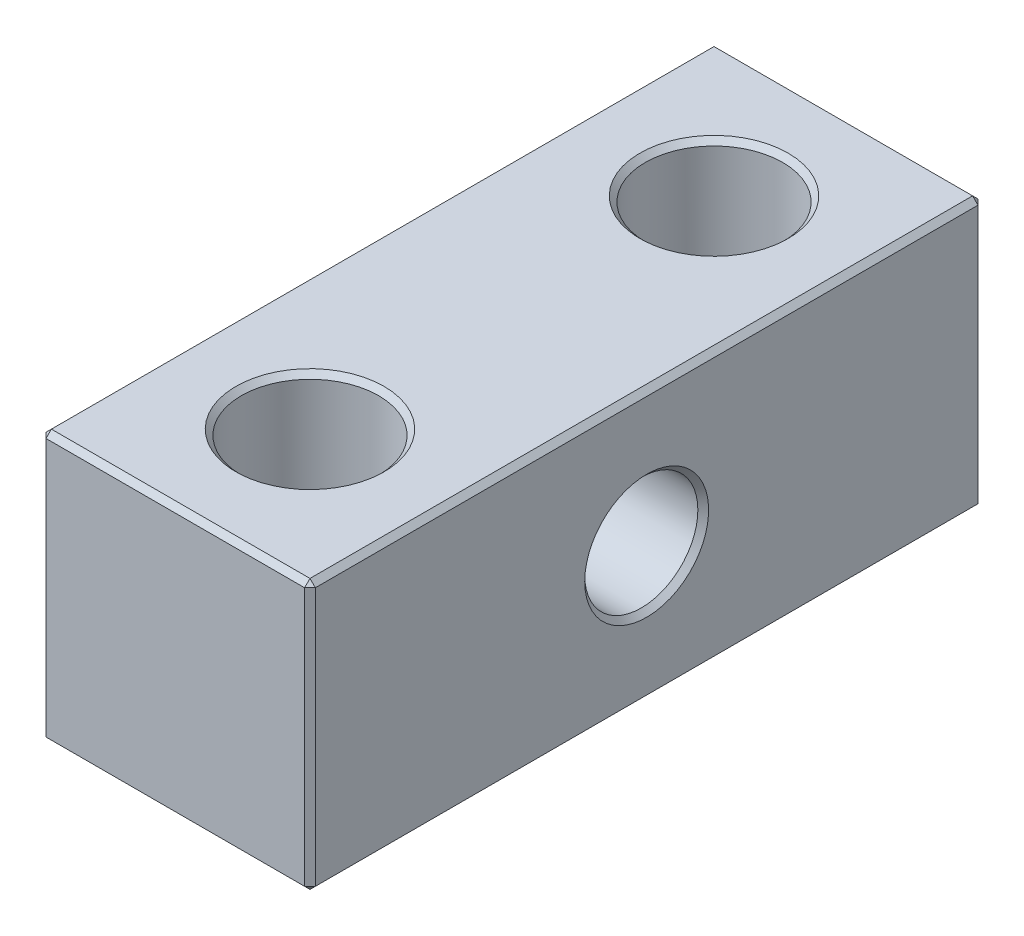
from build123d import *

# Parameters (mm, degrees)
SKETCH_1_W              = 10
SKETCH_1_H              = 10
EXTRUDE_1_DEPTH         = 12.5
HOLE_WIZARD_M5_1_D      = 4.2
HOLE_WIZARD_5_1_5_1_1_D = 5.1
CHAMFER_1_SIZE          = 0.2


with BuildPart() as part:
    # 草图1 → 凸台-拉伸1 (new, symmetric)
    with BuildSketch(Plane.XY):
        Rectangle(SKETCH_1_W, SKETCH_1_H)
    extrude(amount=EXTRUDE_1_DEPTH, both=True)

    # M5 螺纹孔1 (through all)
    with Locations(Plane(origin=(5, 0, 0), x_dir=(0, 0, -1), z_dir=(1, 0, 0))):
        with Locations((0, 0)):
            Hole(HOLE_WIZARD_M5_1_D / 2)

    # Ø5.1 (5.1) 直径孔1 (through all)
    with Locations(Plane(origin=(0, 5, 0), x_dir=(1, 0, 0), z_dir=(0, 1, 0))):
        with Locations((0, -7.5), (0, 7.5)):
            Hole(HOLE_WIZARD_5_1_5_1_1_D / 2)

    # 倒角1
    chamfer_1_edges = [part.edges().sort_by_distance(p)[0] for p in [
        (-5, 0, 12.5),
        (5, 0, -2.1),
        (-5, 0, -2.1),
        (0, -5, 12.5),
        (2.55, 5, -7.5),
        (2.55, -5, -7.5),
        (2.55, 5, 7.5),
        (2.55, -5, 7.5),
        (5, 0, 12.5),
        (0, -5, -12.5),
        (-5, 0, -12.5),
        (0, 5, -12.5),
        (5, 0, -12.5),
        (5, -5, 0),
        (-5, -5, 0),
        (-5, 5, 0),
        (5, 5, 0),
        (0, 5, 12.5),
    ]]
    chamfer(chamfer_1_edges, length=CHAMFER_1_SIZE)


solid = part.part
